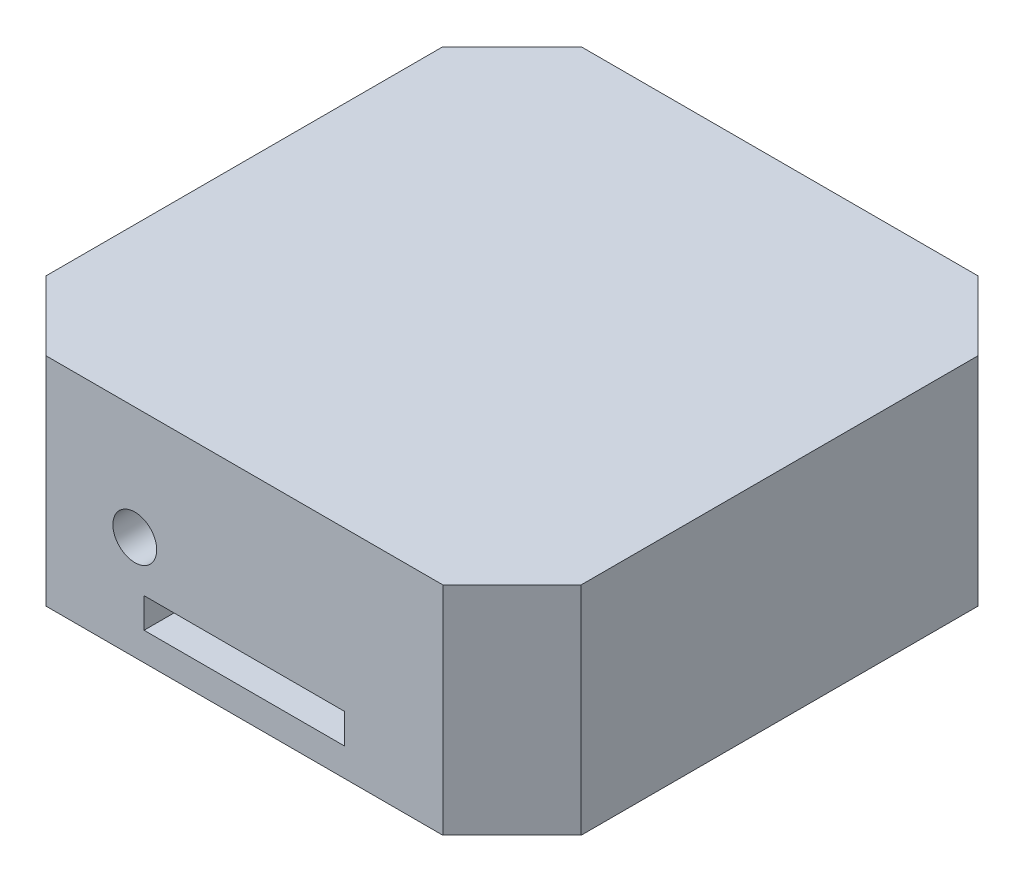
from build123d import *

# Parameters (mm, degrees)
BOSS_EXTRUDE1_DEPTH = 47
SKETCH3_R           = 4.75
SKETCH3_W           = 43.5
SKETCH3_H           = 6.5
CUT_EXTRUDE1_DEPTH  = 10


with BuildPart() as part:
    # Sketch2 → Boss-Extrude1 (new body)
    with BuildSketch(Plane(origin=(0, 0, 0), x_dir=(1, 0, 0), z_dir=(0, 1, 0))):
        Polygon((-43, 58), (43, 58), (58, 43), (58, -43), (43, -58), (-43, -58), (-58, -43), (-58, 43), align=None)
    extrude(amount=BOSS_EXTRUDE1_DEPTH)

    # Sketch3 → Cut-Extrude1 (cut)
    with BuildSketch(Plane.XY.offset(58)):
        with Locations((-23.75, 22.55)):
            Circle(SKETCH3_R)
        with Locations((0, 9.35)):
            Rectangle(SKETCH3_W, SKETCH3_H)
    extrude(amount=-CUT_EXTRUDE1_DEPTH, mode=Mode.SUBTRACT)


solid = part.part
